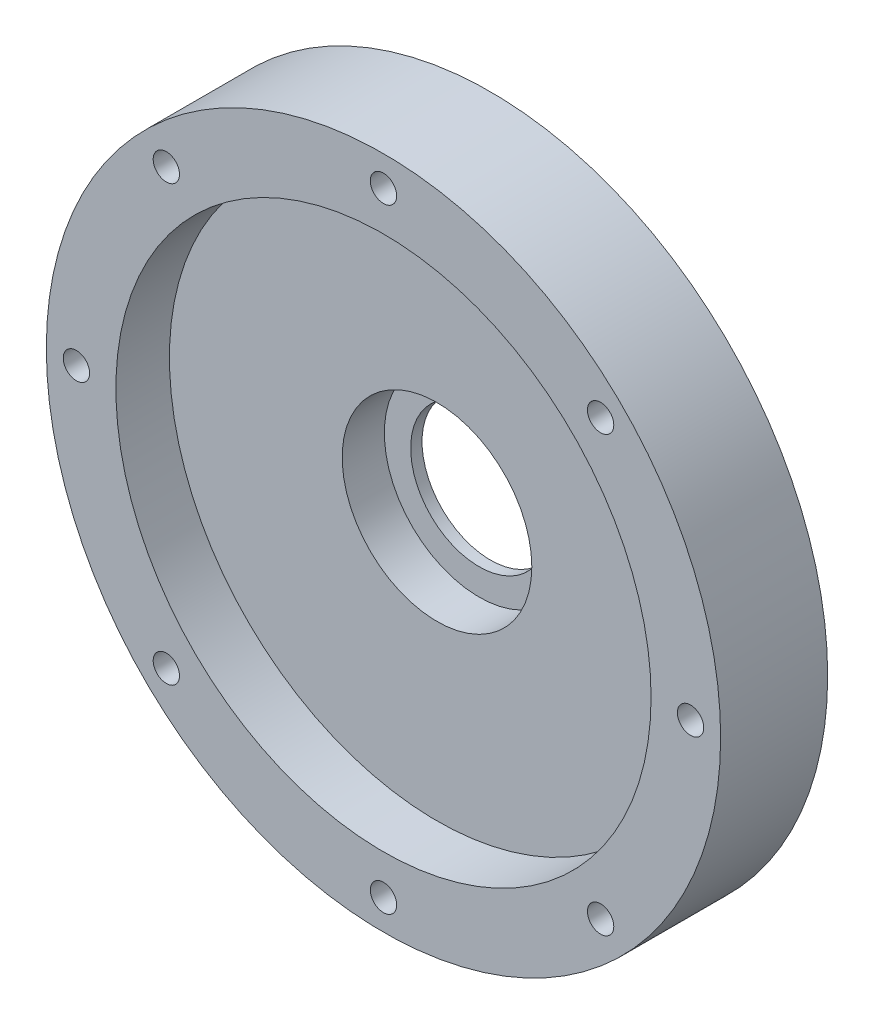
from build123d import *

# Parameters (mm, degrees)
SKETCH1_R             = 32.004
BOSS_EXTRUDE1_DEPTH   = 10.16
SKETCH2_R             = 25.4
CUT_EXTRUDE1_DEPTH    = 5.08
SKETCH3_R             = 9
CUT_EXTRUDE2_DEPTH    = 4
SKETCH4_R             = 6.5
CUT_EXTRUDE3_DEPTH    = 47.162305315
M3X0_5_TAPPED_HOLE1_D = 2.5


with BuildPart() as part:
    # Sketch1 → Boss-Extrude1 (new body)
    with BuildSketch(Plane.XY):
        Circle(SKETCH1_R)
    extrude(amount=BOSS_EXTRUDE1_DEPTH)

    # Sketch2 → Cut-Extrude1 (cut)
    with BuildSketch(Plane.XY.offset(10.16)):
        Circle(SKETCH2_R)
    extrude(amount=-CUT_EXTRUDE1_DEPTH, mode=Mode.SUBTRACT)

    # Sketch3 → Cut-Extrude2 (cut)
    with BuildSketch(Plane.XY.offset(5.08)):
        Circle(SKETCH3_R)
    extrude(amount=-CUT_EXTRUDE2_DEPTH, mode=Mode.SUBTRACT)

    # Sketch4 → Cut-Extrude3 (cut, through all)
    with BuildSketch(Plane.XY.offset(1.08)):
        Circle(SKETCH4_R)
    extrude(amount=-CUT_EXTRUDE3_DEPTH, mode=Mode.SUBTRACT)

    # M3x0.5 Tapped Hole1 (through all)
    with Locations(Plane.XY.offset(10.16)):
        with Locations((-20.609687798, 20.609687798), (0, 29.1465), (20.609687798, 20.609687798), (29.1465, 0), (20.609687798, -20.609687798), (0, -29.1465), (-20.609687798, -20.609687798), (-29.1465, 0)):
            Hole(M3X0_5_TAPPED_HOLE1_D / 2)


solid = part.part
